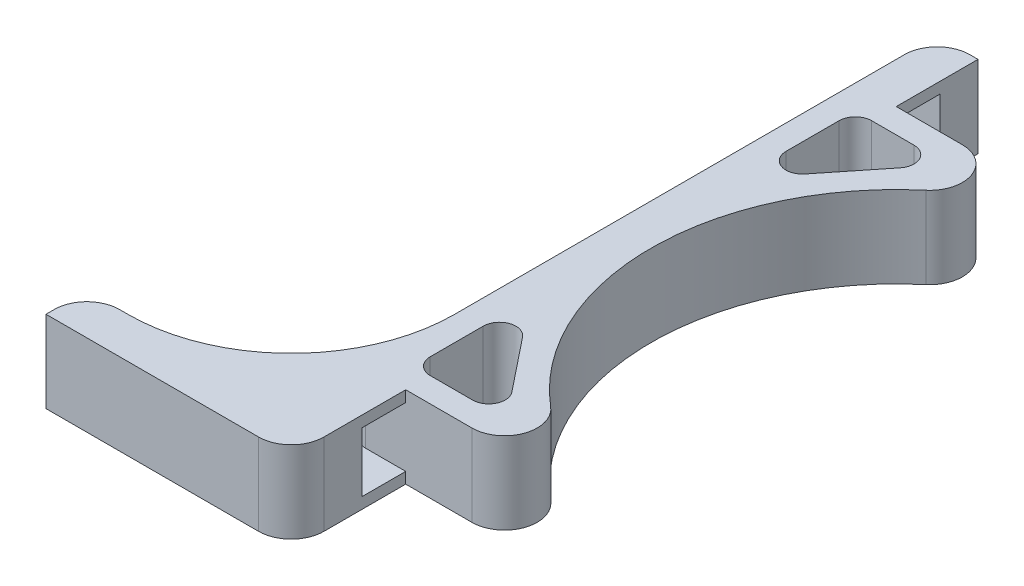
from build123d import *

# Parameters (mm, degrees)
BOSS_EXTRUDE1_DEPTH = 6.35
FILLET1_R           = 2.54
SKETCH2_W           = 3.39204747
SKETCH2_H           = 4.630409642
CUT_EXTRUDE1_DEPTH  = 57.994566408
FILLET2_R           = 1.27


with BuildPart() as part:
    # Sketch1 → Boss-Extrude1 (new body)
    with BuildSketch(Plane(origin=(0, 0, 0), x_dir=(1, 0, 0), z_dir=(0, 1, 0))):
        with BuildLine():
            Line((0, 0), (16.51, 0))
            ThreePointArc((16.51, 0), (18.306051224, 0.743948776), (19.05, 2.54))
            Line((19.05, 2.54), (19.05, 8.89))
            Line((19.05, 8.89), (38.1, 8.89))
            ThreePointArc((38.1, 8.89), (19.05, 27.94), (38.1, 46.99))
            Line((38.1, 46.99), (19.05, 46.99))
            Line((19.05, 46.99), (19.05, 53.34))
            Line((19.05, 53.34), (18.415, 53.34))
            ThreePointArc((18.415, 53.34), (16.618948776, 52.596051224), (15.875, 50.8))
            Line((15.875, 50.8), (15.875, 15.875))
            ThreePointArc((15.875, 15.875), (12.155256121, 6.894743879), (3.175, 3.175))
            Line((3.175, 3.175), (2.54, 3.175))
            ThreePointArc((2.54, 3.175), (0.743948776, 2.431051224), (0, 0.635))
            Line((0, 0.635), (0, 0))
        make_face()
        Polygon((24.973677906, 10.795), (17.78, 19.806028114), (17.78, 10.795), align=None, mode=Mode.SUBTRACT)
        Polygon((17.78, 45.085), (24.973677906, 45.085), (17.78, 36.073971886), align=None, mode=Mode.SUBTRACT)
    extrude(amount=BOSS_EXTRUDE1_DEPTH)

    # Fillet1
    fillet1_edges = [part.edges().sort_by_distance(p)[0] for p in [
        (38.1, 3.175, -46.99),
        (38.1, 3.175, -8.89),
    ]]
    fillet(fillet1_edges, radius=FILLET1_R)

    # Sketch2 → Cut-Extrude1 (cut, through all)
    with BuildSketch(Plane(origin=(19.05, 0, 0), x_dir=(0, 0, -1), z_dir=(1, 0, 0))):
        with Locations((7.193976265, 3.175)):
            Rectangle(SKETCH2_W, SKETCH2_H)
        with Locations((48.686023735, 3.175)):
            Rectangle(SKETCH2_W, SKETCH2_H)
    extrude(amount=-CUT_EXTRUDE1_DEPTH, mode=Mode.SUBTRACT)

    # Fillet2
    fillet2_edges = [part.edges().sort_by_distance(p)[0] for p in [
        (17.78, 3.175, -10.795),
        (24.973677906, 3.175, -10.795),
        (17.78, 3.175, -19.806028114),
        (17.78, 3.175, -36.073971886),
        (24.973677906, 3.175, -45.085),
        (17.78, 3.175, -45.085),
        (13.781591111, 3.175, -8.89),
        (15.875, 3.175, -46.99),
    ]]
    fillet(fillet2_edges, radius=FILLET2_R)


solid = part.part
